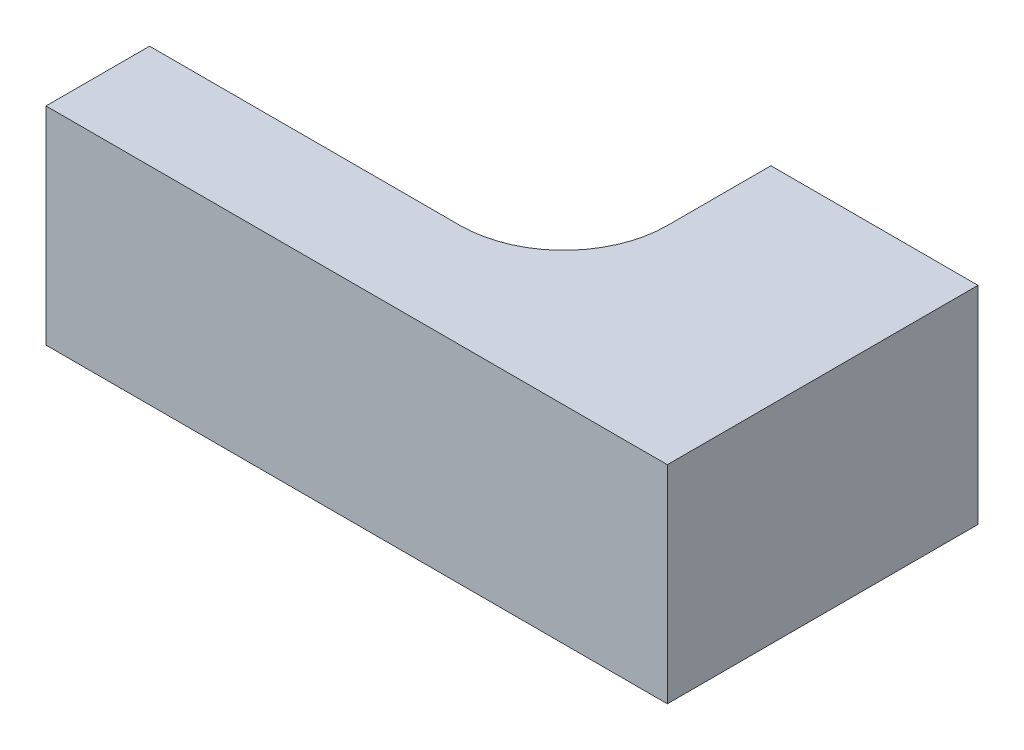
from build123d import *

# Parameters (mm, degrees)
BOSS_EXTRUDE1_DEPTH = 20


with BuildPart() as part:
    # Sketch2 → Boss-Extrude1 (new body)
    with BuildSketch(Plane(origin=(0, 0, 0), x_dir=(1, 0, 0), z_dir=(0, 1, 0))):
        with BuildLine():
            Line((0, 0), (0, -10))
            ThreePointArc((0, -10), (2.928932188, -17.071067812), (10, -20))
            Line((10, -20), (40, -20))
            Line((40, -20), (40, -30))
            Line((40, -30), (-20, -30))
            Line((-20, -30), (-20, 0))
            Line((-20, 0), (0, 0))
        make_face()
    extrude(amount=BOSS_EXTRUDE1_DEPTH)


with BuildPart() as body_2:
    # Mirror1: mirrored copy
    add(part.part.mirror(Plane(origin=(-20, 20, 30), x_dir=(0, 0, 1), z_dir=(1, 0, 0))))


solid = body_2.part
